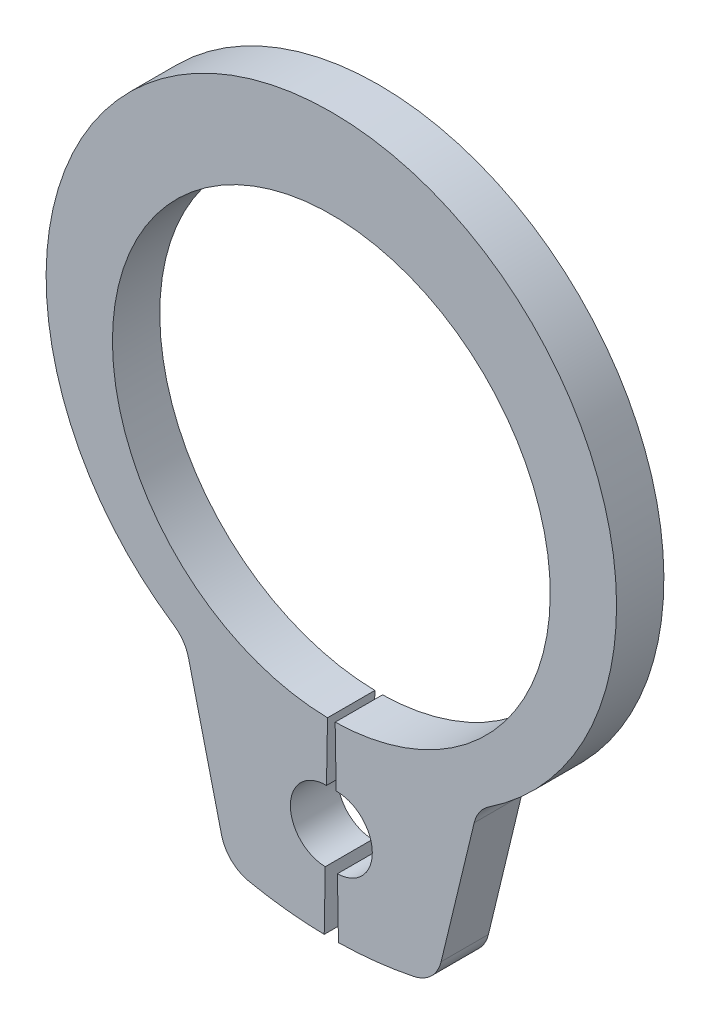
from build123d import *

# Parameters (mm, degrees)
BOSS_EXTRUDE1_DEPTH = 0.4
FILLET1_R           = 0.6


with BuildPart() as part:
    # Sketch1 → Boss-Extrude1 (new, symmetric)
    with BuildSketch(Plane.XY):
        with BuildLine():
            Line((-0.064573904, -3.699436472), (-0.08202631, -4.699284167))
            ThreePointArc((-0.08202631, -4.699284167), (-0.692406371, -5.28872134), (-0.102969198, -5.899101401))
            Line((-0.102969198, -5.899101401), (-0.120421604, -6.898949097))
            ThreePointArc((-0.120421604, -6.898949097), (-0.95172367, -6.834048731), (-1.769127189, -6.669346969))
            Line((-1.769127189, -6.669346969), (-2.471645104, -3.760448175))
            ThreePointArc((-2.471645104, -3.760448175), (0, 5.2), (2.471645104, -3.760448175))
            Line((2.471645104, -3.760448175), (1.769127189, -6.669346969))
            ThreePointArc((1.769127189, -6.669346969), (0.95172367, -6.834048731), (0.120421604, -6.898949097))
            Line((0.120421604, -6.898949097), (0.102969198, -5.899101401))
            ThreePointArc((0.102969198, -5.899101401), (0.692406371, -5.28872134), (0.08202631, -4.699284167))
            Line((0.08202631, -4.699284167), (0.064573904, -3.699436472))
            ThreePointArc((0.064573904, -3.699436472), (0, 3.7), (-0.064573904, -3.699436472))
        make_face()
    extrude(amount=BOSS_EXTRUDE1_DEPTH, both=True)

    # Fillet1
    fillet1_edges = [part.edges().sort_by_distance(p)[0] for p in [
        (-1.769127189, -6.669346969, 0),
        (-2.471645104, -3.760448175, 0),
        (2.471645104, -3.760448175, 0),
        (1.769127189, -6.669346969, 0),
    ]]
    fillet(fillet1_edges, radius=FILLET1_R)


solid = part.part
